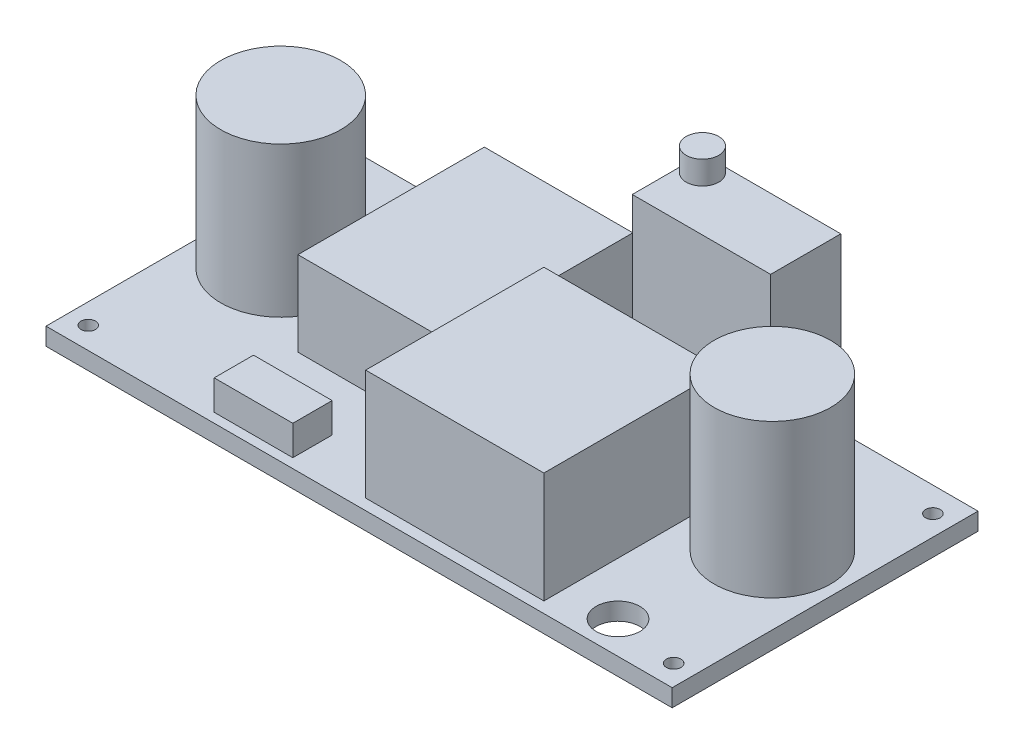
from build123d import *

# Parameters (mm, degrees)
SKETCH1_W           = 43
SKETCH1_H           = 21
BOSS_EXTRUDE1_DEPTH = 1.2
SKETCH2_R           = 0.5
CUT_EXTRUDE1_DEPTH  = 48.868987873
SKETCH3_R           = 1.5
CUT_EXTRUDE2_DEPTH  = 48.868987873
SKETCH4_W           = 9.5
SKETCH4_H           = 4.82
BOSS_EXTRUDE2_DEPTH = 11.88
SKETCH5_R           = 1.12
BOSS_EXTRUDE3_DEPTH = 1.6
SKETCH6_W           = 7.46
SKETCH6_H           = 2.45
BOSS_EXTRUDE4_DEPTH = 0.6
SKETCH7_W           = 12.24
SKETCH7_H           = 12.24
BOSS_EXTRUDE5_DEPTH = 7.61
SKETCH8_W           = 10.2
SKETCH8_H           = 12.8
BOSS_EXTRUDE6_DEPTH = 5.8
SKETCH9_W           = 5.4
SKETCH9_H           = 2.7
BOSS_EXTRUDE7_DEPTH = 2.05
SKETCH10_R          = 4.12
BOSS_EXTRUDE8_DEPTH = 10.3
SKETCH11_R          = 4
BOSS_EXTRUDE9_DEPTH = 10.5


with BuildPart() as part:
    # Sketch1 → Boss-Extrude1 (new body)
    with BuildSketch(Plane(origin=(0, 0, 0), x_dir=(1, 0, 0), z_dir=(0, 1, 0))):
        with Locations((21.5, 10.5)):
            Rectangle(SKETCH1_W, SKETCH1_H)
    extrude(amount=BOSS_EXTRUDE1_DEPTH)

    # Sketch2 → Cut-Extrude1 (cut, through all)
    with BuildSketch(Plane(origin=(0, 1.2, 0), x_dir=(1, 0, 0), z_dir=(0, 1, 0))):
        with Locations((1.4, 19.3)):
            Circle(SKETCH2_R)
        with Locations((1.4, 1.5)):
            Circle(SKETCH2_R)
        with Locations((41.6, 19.3)):
            Circle(SKETCH2_R)
        with Locations((41.6, 1.5)):
            Circle(SKETCH2_R)
    extrude(amount=-CUT_EXTRUDE1_DEPTH, mode=Mode.SUBTRACT)

    # Sketch3 → Cut-Extrude2 (cut, through all)
    with BuildSketch(Plane(origin=(0, 1.2, 0), x_dir=(1, 0, 0), z_dir=(0, 1, 0))):
        with Locations((5.9, 18.94)):
            Circle(SKETCH3_R)
        with Locations((37.05, 2.23)):
            Circle(SKETCH3_R)
    extrude(amount=-CUT_EXTRUDE2_DEPTH, mode=Mode.SUBTRACT)

    # Sketch4 → Boss-Extrude2 (add)
    with BuildSketch(Plane(origin=(0, 1.2, 0), x_dir=(1, 0, 0), z_dir=(0, 1, 0))):
        with Locations((28.93, 18.49)):
            Rectangle(SKETCH4_W, SKETCH4_H)
    extrude(amount=BOSS_EXTRUDE2_DEPTH)

    # Sketch5 → Boss-Extrude3 (add)
    with BuildSketch(Plane(origin=(0, 13.08, 0), x_dir=(1, 0, 0), z_dir=(0, 1, 0))):
        with Locations((25.3, 19.78)):
            Circle(SKETCH5_R)
    extrude(amount=BOSS_EXTRUDE3_DEPTH)

    # Sketch6 → Boss-Extrude4 (add)
    with BuildSketch(Plane.XZ):
        with Locations((29.47, -18.275)):
            Rectangle(SKETCH6_W, SKETCH6_H)
    extrude(amount=BOSS_EXTRUDE4_DEPTH)

    # Sketch7 → Boss-Extrude5 (add)
    with BuildSketch(Plane(origin=(0, 1.2, 0), x_dir=(1, 0, 0), z_dir=(0, 1, 0))):
        with Locations((27.32, 6.87)):
            Rectangle(SKETCH7_W, SKETCH7_H)
    extrude(amount=BOSS_EXTRUDE5_DEPTH)

    # Sketch8 → Boss-Extrude6 (add)
    with BuildSketch(Plane(origin=(0, 1.2, 0), x_dir=(1, 0, 0), z_dir=(0, 1, 0))):
        with Locations((15.3, 13.5)):
            Rectangle(SKETCH8_W, SKETCH8_H)
    extrude(amount=BOSS_EXTRUDE6_DEPTH)

    # Sketch9 → Boss-Extrude7 (add)
    with BuildSketch(Plane(origin=(0, 1.2, 0), x_dir=(1, 0, 0), z_dir=(0, 1, 0))):
        with Locations((13.6, 2)):
            Rectangle(SKETCH9_W, SKETCH9_H)
    extrude(amount=BOSS_EXTRUDE7_DEPTH)

    # Sketch10 → Boss-Extrude8 (add)
    with BuildSketch(Plane(origin=(0, 1.2, 0), x_dir=(1, 0, 0), z_dir=(0, 1, 0))):
        with Locations((4.62, 11.5)):
            Circle(SKETCH10_R)
    extrude(amount=BOSS_EXTRUDE8_DEPTH)

    # Sketch11 → Boss-Extrude9 (add)
    with BuildSketch(Plane(origin=(0, 1.2, 0), x_dir=(1, 0, 0), z_dir=(0, 1, 0))):
        with Locations((38.28, 11.6)):
            Circle(SKETCH11_R)
    extrude(amount=BOSS_EXTRUDE9_DEPTH)


solid = part.part
